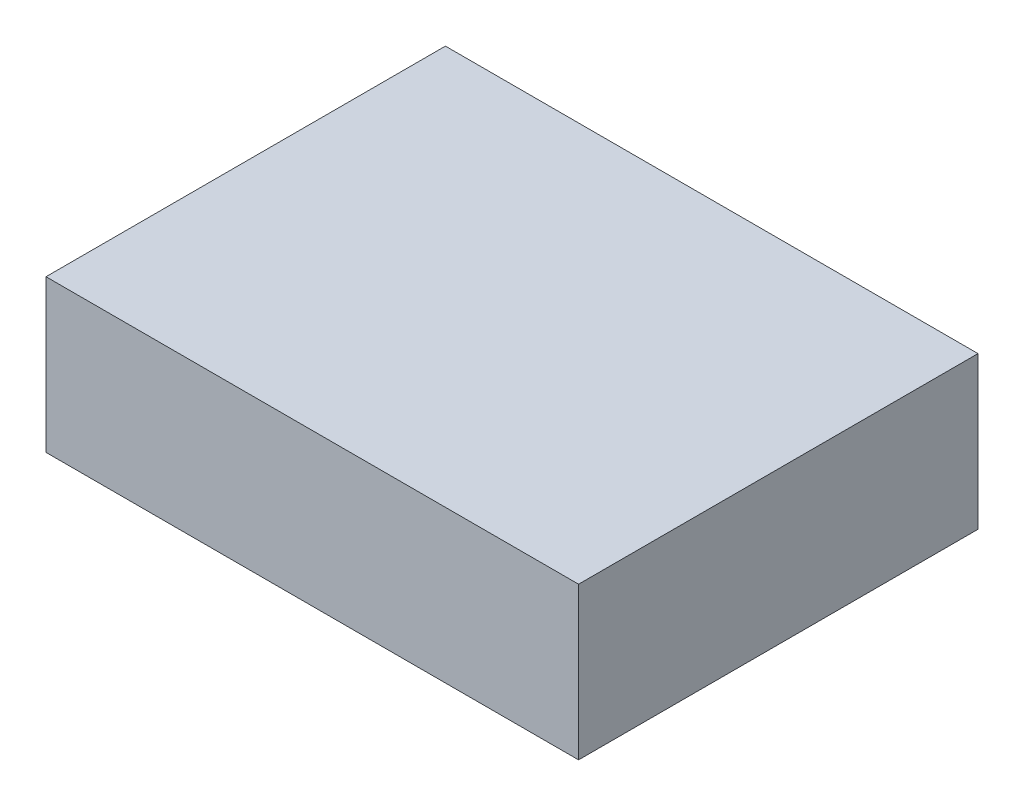
from build123d import *

# Parameters (mm, degrees)
SKETCH1_W           = 88.9
SKETCH1_H           = 66.675
BOSS_EXTRUDE1_DEPTH = 25.4


with BuildPart() as part:
    # Sketch1 → Boss-Extrude1 (new body)
    with BuildSketch(Plane(origin=(0, 0, 0), x_dir=(1, 0, 0), z_dir=(0, 1, 0))):
        with Locations((44.45, 33.3375)):
            Rectangle(SKETCH1_W, SKETCH1_H)
    extrude(amount=BOSS_EXTRUDE1_DEPTH)


solid = part.part
